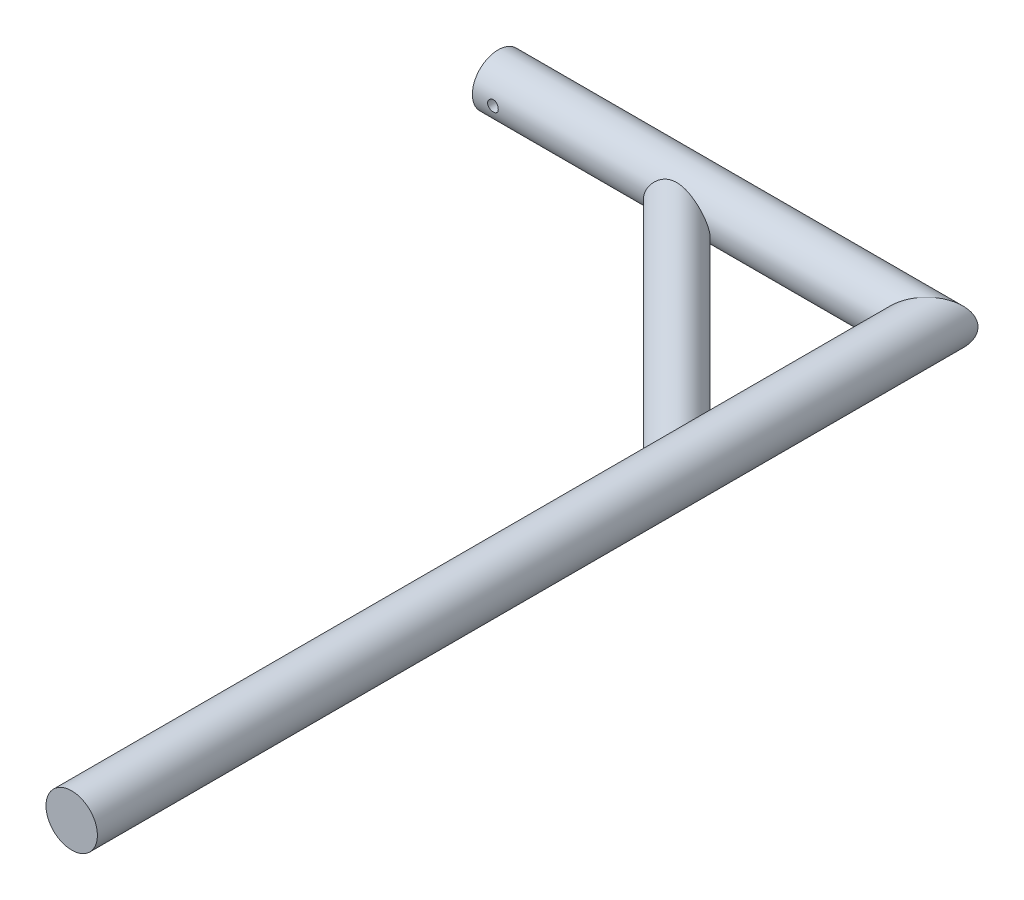
from build123d import *

# Parameters (mm, degrees)
SWEEP1_PROFILE_R         = 24
EXTRUDE_THIN2_DEPTH      = 152
EXTRUDE_THIN2_DEPTH_BACK = 155
SKETCH10_R               = 22
SKETCH10_R_2             = 20
CUT_EXTRUDE1_DEPTH       = 894.045895024
CUT_EXTRUDE1_DEPTH_BACK  = 894.045895024
SKETCH12_R               = 5


with BuildPart() as part:
    # Sweep1: sweep along a path in Sketch1
    with BuildLine(Plane(origin=(0, 0, 0), x_dir=(1, 0, 0), z_dir=(0, 1, 0))) as sweep1_path:
        Line((0, -798), (0, 0))
        Line((0, 0), (-400, 0))
    # Sweep1 profile (on start of the path) → Sweep1 (sweep)
    with BuildSketch(Plane(origin=(0, 0, 798), x_dir=(-1, 0, 0), z_dir=(0, 0, -1))):
        Circle(SWEEP1_PROFILE_R)
    sweep(path=sweep1_path.line, transition=Transition.RIGHT)

    # Sketch10 → Extrude-Thin2 (add, two sides: drawn at the far end of the back side and taken through both)
    with BuildSketch(Plane(origin=(0, 0, 0), x_dir=(0.7071067811865478, 0, -0.7071067811865474), z_dir=(0.7071067811865474, 0, 0.7071067811865478)).offset(-EXTRUDE_THIN2_DEPTH_BACK)):
        with Locations((-164.890252441, -4.962388141)):
            Circle(SKETCH10_R)
        with Locations((-164.890252441, -4.962388141)):
            Circle(SKETCH10_R_2, mode=Mode.SUBTRACT)
    extrude(amount=EXTRUDE_THIN2_DEPTH + EXTRUDE_THIN2_DEPTH_BACK)

    # Sketch12 → Cut-Extrude1 (cut, two sides: drawn at the far end of the back side and taken through both)
    with BuildSketch(Plane.XY.offset(-CUT_EXTRUDE1_DEPTH_BACK)):
        with Locations((-380.829639142, 0)):
            Circle(SKETCH12_R)
    extrude(amount=CUT_EXTRUDE1_DEPTH + CUT_EXTRUDE1_DEPTH_BACK, mode=Mode.SUBTRACT)


solid = part.part
